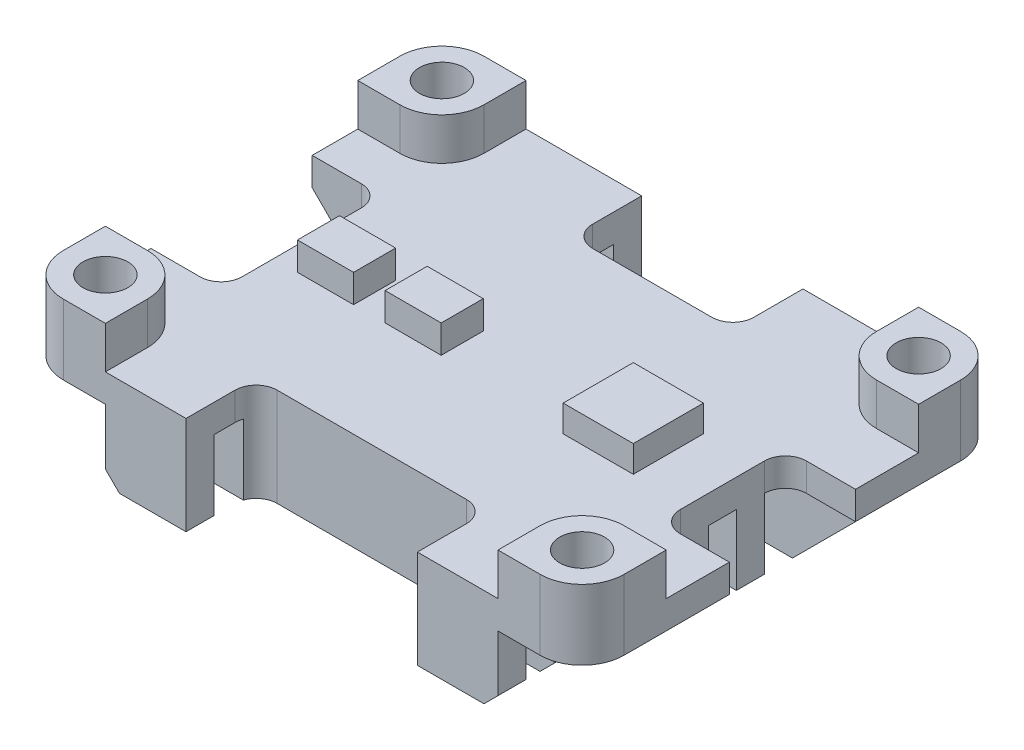
from build123d import *

# Parameters (mm, degrees)
SKETCH_1_R          = 1.6
EXTRUDE_1_DEPTH     = 7
SKETCH_2_R          = 1.6
SKETCH_2_W          = 5
SKETCH_2_H          = 5
SKETCH_2_W_2        = 4
SKETCH_2_H_2        = 3
EXTRUDE_2_DEPTH     = 3
CUT_EXTRUDE_1_DEPTH = 31
CUT_EXTRUDE_START   = -5
SKETCH_5_W          = 40
SKETCH_5_H          = 2
SKETCH_5_W_2        = 30
CUT_EXTRUDE_2_DEPTH = 5
CUT_EXTRUDE_START_2 = -31
SKETCH_6_R          = 1.6
CUT_EXTRUDE_3_DEPTH = 31
CHAMFER_1_SIZE      = 5
CHAMFER_2_SIZE      = 5
CHAMFER_3_SIZE      = 1
SKETCH_7_W          = 9.893762321
SKETCH_7_H          = 9.992699944
CUT_EXTRUDE_4_DEPTH = 1.1
SKETCH_8_W          = 19.688587018
SKETCH_8_H          = 7.420321741
CUT_EXTRUDE_5_DEPTH = 1


with BuildPart() as part:
    # Эскиз1 → Бобышка-Вытянуть1 (new body)
    with BuildSketch(Plane(origin=(0, 0, 0), x_dir=(1, 0, 0), z_dir=(0, 1, 0))):
        with BuildLine():
            Line((-17, 15), (17, 15))
            ThreePointArc((17, 15), (19.121320344, 14.121320344), (20, 12))
            Line((20, 12), (20, -12))
            ThreePointArc((20, -12), (19.121320344, -14.121320344), (17, -15))
            Line((17, -15), (-17, -15))
            ThreePointArc((-17, -15), (-19.121320344, -14.121320344), (-20, -12))
            Line((-20, -12), (-20, 12))
            ThreePointArc((-20, 12), (-19.121320344, 14.121320344), (-17, 15))
        make_face()
        with Locations(Location((-17, 12, 0), (0, 0, 270))):
            Circle(SKETCH_1_R, mode=Mode.SUBTRACT)
        with Locations(Location((17, 12, 0), (0, 0, 270))):
            Circle(SKETCH_1_R, mode=Mode.SUBTRACT)
        with Locations(Location((17, -12, 0), (0, 0, 270))):
            Circle(SKETCH_1_R, mode=Mode.SUBTRACT)
        with Locations(Location((-17, -12, 0), (0, 0, 270))):
            Circle(SKETCH_1_R, mode=Mode.SUBTRACT)
    extrude(amount=EXTRUDE_1_DEPTH)

    # Эскиз2 → Бобышка-Вытянуть2 (add)
    # profile 1 of 7: a face of its own
    with BuildSketch(Plane(origin=(0, 7, 0), x_dir=(1, 0, 0), z_dir=(0, 1, 0))):
        with BuildLine():
            Line((-17, 9), (-20, 9))
            Line((-20, 9), (-20, 12))
            ThreePointArc((-20, 12), (-19.121320344, 14.121320344), (-17, 15))
            Line((-17, 15), (-14, 15))
            Line((-14, 15), (-14, 12))
            ThreePointArc((-14, 12), (-14.878679656, 9.878679656), (-17, 9))
        make_face()
        with Locations(Location((-17, 12, 0), (0, 0, 270))):
            Circle(SKETCH_2_R, mode=Mode.SUBTRACT)
    # profile 2 of 7: a face of its own
    with BuildSketch(Plane(origin=(0, 7, 0), x_dir=(1, 0, 0), z_dir=(0, 1, 0))):
        with BuildLine():
            Line((14, 12), (14, 15))
            Line((14, 15), (17, 15))
            ThreePointArc((17, 15), (19.121320344, 14.121320344), (20, 12))
            Line((20, 12), (20, 9))
            Line((20, 9), (17, 9))
            ThreePointArc((17, 9), (14.878679656, 9.878679656), (14, 12))
        make_face()
        with Locations(Location((17, 12, 0), (0, 0, 270))):
            Circle(SKETCH_2_R, mode=Mode.SUBTRACT)
    # profile 3 of 7: a face of its own
    with BuildSketch(Plane(origin=(0, 7, 0), x_dir=(1, 0, 0), z_dir=(0, 1, 0))):
        with BuildLine():
            Line((17, -9), (20, -9))
            Line((20, -9), (20, -12))
            ThreePointArc((20, -12), (19.121320344, -14.121320344), (17, -15))
            Line((17, -15), (14, -15))
            Line((14, -15), (14, -12))
            ThreePointArc((14, -12), (14.878679656, -9.878679656), (17, -9))
        make_face()
        with Locations(Location((17, -12, 0), (0, 0, 270))):
            Circle(SKETCH_2_R, mode=Mode.SUBTRACT)
    # profile 4 of 7: a face of its own
    with BuildSketch(Plane(origin=(0, 7, 0), x_dir=(1, 0, 0), z_dir=(0, 1, 0))):
        with BuildLine():
            Line((-17, -9), (-20, -9))
            Line((-20, -9), (-20, -12))
            ThreePointArc((-20, -12), (-19.121320344, -14.121320344), (-17, -15))
            Line((-17, -15), (-14, -15))
            Line((-14, -15), (-14, -12))
            ThreePointArc((-14, -12), (-14.878679656, -9.878679656), (-17, -9))
        make_face()
        with Locations(Location((-17, -12, 0), (0, 0, 270))):
            Circle(SKETCH_2_R, mode=Mode.SUBTRACT)
    # profile 5 of 7: a face of its own
    with BuildSketch(Plane(origin=(0, 7, 0), x_dir=(1, 0, 0), z_dir=(0, 1, 0))):
        with Locations((8.65, 0)):
            Rectangle(SKETCH_2_W, SKETCH_2_H)
    # profile 6 of 7: a face of its own
    with BuildSketch(Plane(origin=(0, 7, 0), x_dir=(1, 0, 0), z_dir=(0, 1, 0))):
        with Locations((-5.05, -0.5)):
            Rectangle(SKETCH_2_W_2, SKETCH_2_H_2)
    # profile 7 of 7: a face of its own
    with BuildSketch(Plane(origin=(0, 7, 0), x_dir=(1, 0, 0), z_dir=(0, 1, 0))):
        with Locations((-11.3, -0.5)):
            Rectangle(SKETCH_2_W_2, SKETCH_2_H_2)
    extrude(amount=EXTRUDE_2_DEPTH)

    # Эскиз4 → Вырез-Вытянуть1 (cut)
    with BuildSketch(Plane.XZ):
        with BuildLine():
            Line((-5.75, -20), (5.75, -20))
            Line((5.75, -20), (5.75, -11.5))
            ThreePointArc((5.75, -11.5), (5.310660172, -10.439339828), (4.25, -10))
            Line((4.25, -10), (-4.25, -10))
            ThreePointArc((-4.25, -10), (-5.310660172, -10.439339828), (-5.75, -11.5))
            Line((-5.75, -11.5), (-5.75, -20))
        make_face()
        with BuildLine():
            Line((-25, 5.75), (-16.5, 5.75))
            ThreePointArc((-16.5, 5.75), (-15.439339828, 5.310660172), (-15, 4.25))
            Line((-15, 4.25), (-15, -4.25))
            ThreePointArc((-15, -4.25), (-15.439339828, -5.310660172), (-16.5, -5.75))
            Line((-16.5, -5.75), (-25, -5.75))
            Line((-25, -5.75), (-25, 5.75))
        make_face()
        with BuildLine():
            Line((-8.25, 20), (8.25, 20))
            Line((8.25, 20), (8.25, 11.5))
            ThreePointArc((8.25, 11.5), (7.810660172, 10.439339828), (6.75, 10))
            Line((6.75, 10), (-6.75, 10))
            ThreePointArc((-6.75, 10), (-7.810660172, 10.439339828), (-8.25, 11.5))
            Line((-8.25, 11.5), (-8.25, 20))
        make_face()
        with BuildLine():
            Line((25, 4.5), (16.5, 4.5))
            ThreePointArc((16.5, 4.5), (15.439339828, 4.060660172), (15, 3))
            Line((15, 3), (15, -3))
            ThreePointArc((15, -3), (15.439339828, -4.060660172), (16.5, -4.5))
            Line((16.5, -4.5), (25, -4.5))
            Line((25, -4.5), (25, 4.5))
        make_face()
    extrude(amount=-CUT_EXTRUDE_1_DEPTH, mode=Mode.SUBTRACT)

    # Эскиз5 → Вырез-Вытянуть2 (cut)
    with BuildSketch(Plane.XZ.offset(CUT_EXTRUDE_START)):
        with BuildLine():
            Line((-5.664213562, -11), (-15.7510004, -11))
            ThreePointArc((-15.7510004, -11), (-15.490298149, -11.470094046), (-15.4, -12))
            ThreePointArc((-15.4, -12), (-15.490298149, -12.529905954), (-15.7510004, -13))
            Line((-15.7510004, -13), (-5.75, -13))
            Line((-5.75, -13), (-5.75, -11.5))
            ThreePointArc((-5.75, -11.5), (-5.728397839, -11.246347032), (-5.664213562, -11))
        make_face()
        with BuildLine():
            ThreePointArc((15.7510004, -13), (15.4, -12), (15.7510004, -11))
            Line((15.7510004, -11), (5.664213562, -11))
            ThreePointArc((5.664213562, -11), (5.728397839, -11.246347032), (5.75, -11.5))
            Line((5.75, -11.5), (5.75, -13))
            Line((5.75, -13), (15.7510004, -13))
        make_face()
        with BuildLine():
            Line((20, -12), (20, -11))
            Line((20, -11), (18.2489996, -11))
            ThreePointArc((18.2489996, -11), (18.509701851, -11.470094046), (18.6, -12))
            ThreePointArc((18.6, -12), (18.509701851, -12.529905954), (18.2489996, -13))
            Line((18.2489996, -13), (19.828427125, -13))
            ThreePointArc((19.828427125, -13), (19.956795679, -12.507305936), (20, -12))
        make_face()
        with BuildLine():
            Line((-18.2489996, -11), (-20, -11))
            Line((-20, -11), (-20, -12))
            ThreePointArc((-20, -12), (-19.956795679, -12.507305936), (-19.828427125, -13))
            Line((-19.828427125, -13), (-18.2489996, -13))
            ThreePointArc((-18.2489996, -13), (-18.6, -12), (-18.2489996, -11))
        make_face()
        with Locations((0, -8)):
            Rectangle(SKETCH_5_W, SKETCH_5_H)
        with BuildLine():
            Line((15, -3), (-15, -3))
            Line((-15, -3), (-15, -4.25))
            ThreePointArc((-15, -4.25), (-15.051111261, -4.638228568), (-15.200961894, -5))
            Line((-15.200961894, -5), (20, -5))
            Line((20, -5), (20, -4.5))
            Line((20, -4.5), (16.5, -4.5))
            ThreePointArc((16.5, -4.5), (15.439339828, -4.060660172), (15, -3))
        make_face()
        Rectangle(SKETCH_5_W_2, SKETCH_5_H)
        with BuildLine():
            Line((20, 5), (-15.200961894, 5))
            ThreePointArc((-15.200961894, 5), (-15.051111261, 4.638228568), (-15, 4.25))
            Line((-15, 4.25), (-15, 3))
            Line((-15, 3), (15, 3))
            ThreePointArc((15, 3), (15.439339828, 4.060660172), (16.5, 4.5))
            Line((16.5, 4.5), (20, 4.5))
            Line((20, 4.5), (20, 5))
        make_face()
        with Locations((0, 8)):
            Rectangle(SKETCH_5_W, SKETCH_5_H)
        with BuildLine():
            ThreePointArc((-15.4, 12), (-15.490298149, 11.470094046), (-15.7510004, 11))
            Line((-15.7510004, 11), (-8.164213562, 11))
            ThreePointArc((-8.164213562, 11), (-8.228397839, 11.246347032), (-8.25, 11.5))
            Line((-8.25, 11.5), (-8.25, 13))
            Line((-8.25, 13), (-15.7510004, 13))
            ThreePointArc((-15.7510004, 13), (-15.490298149, 12.529905954), (-15.4, 12))
        make_face()
        with BuildLine():
            Line((-20, 12), (-20, 11))
            Line((-20, 11), (-18.2489996, 11))
            ThreePointArc((-18.2489996, 11), (-18.6, 12), (-18.2489996, 13))
            Line((-18.2489996, 13), (-19.828427125, 13))
            ThreePointArc((-19.828427125, 13), (-19.956795679, 12.507305936), (-20, 12))
        make_face()
        with BuildLine():
            Line((8.164213562, 11), (15.7510004, 11))
            ThreePointArc((15.7510004, 11), (15.4, 12), (15.7510004, 13))
            Line((15.7510004, 13), (8.25, 13))
            Line((8.25, 13), (8.25, 11.5))
            ThreePointArc((8.25, 11.5), (8.228397839, 11.246347032), (8.164213562, 11))
        make_face()
        with BuildLine():
            Line((18.2489996, 11), (20, 11))
            Line((20, 11), (20, 12))
            ThreePointArc((20, 12), (19.956795679, 12.507305936), (19.828427125, 13))
            Line((19.828427125, 13), (18.2489996, 13))
            ThreePointArc((18.2489996, 13), (18.509701851, 12.529905954), (18.6, 12))
            ThreePointArc((18.6, 12), (18.509701851, 11.470094046), (18.2489996, 11))
        make_face()
    extrude(amount=CUT_EXTRUDE_2_DEPTH, mode=Mode.SUBTRACT)

    # Эскиз6 → Вырез-Вытянуть3 (cut)
    # profile 1 of 4: a face of its own
    with BuildSketch(Plane(origin=(0, 5, 0), x_dir=(1, 0, 0), z_dir=(0, 1, 0)).offset(CUT_EXTRUDE_START_2)):
        with BuildLine():
            Line((14, 12), (14, 9))
            Line((14, 9), (17, 9))
            Line((17, 9), (20, 9))
            Line((20, 9), (20, 12))
            ThreePointArc((20, 12), (19.121320344, 14.121320344), (17, 15))
            Line((17, 15), (14, 15))
            Line((14, 15), (14, 12))
        make_face()
        with Locations(Location((17, 12, 0), (0, 0, 270))):
            Circle(SKETCH_6_R, mode=Mode.SUBTRACT)
    # profile 2 of 4: a face of its own
    with BuildSketch(Plane(origin=(0, 5, 0), x_dir=(1, 0, 0), z_dir=(0, 1, 0)).offset(CUT_EXTRUDE_START_2)):
        with BuildLine():
            Line((14, -12), (14, -9))
            Line((14, -9), (17, -9))
            Line((17, -9), (20, -9))
            Line((20, -9), (20, -12))
            ThreePointArc((20, -12), (19.121320344, -14.121320344), (17, -15))
            Line((17, -15), (14, -15))
            Line((14, -15), (14, -12))
        make_face()
        with Locations(Location((17, -12, 0), (0, 0, 270))):
            Circle(SKETCH_6_R, mode=Mode.SUBTRACT)
    # profile 3 of 4: a face of its own
    with BuildSketch(Plane(origin=(0, 5, 0), x_dir=(1, 0, 0), z_dir=(0, 1, 0)).offset(CUT_EXTRUDE_START_2)):
        with BuildLine():
            Line((-20, 9), (-17, 9))
            Line((-17, 9), (-14, 9))
            Line((-14, 9), (-14, 12))
            Line((-14, 12), (-14, 15))
            Line((-14, 15), (-17, 15))
            ThreePointArc((-17, 15), (-19.121320344, 14.121320344), (-20, 12))
            Line((-20, 12), (-20, 9))
        make_face()
        with Locations(Location((-17, 12, 0), (0, 0, 270))):
            Circle(SKETCH_6_R, mode=Mode.SUBTRACT)
    # profile 4 of 4: a face of its own
    with BuildSketch(Plane(origin=(0, 5, 0), x_dir=(1, 0, 0), z_dir=(0, 1, 0)).offset(CUT_EXTRUDE_START_2)):
        with BuildLine():
            Line((-14, -15), (-14, -12))
            Line((-14, -12), (-14, -9))
            Line((-14, -9), (-17, -9))
            Line((-17, -9), (-20, -9))
            Line((-20, -9), (-20, -12))
            ThreePointArc((-20, -12), (-19.121320344, -14.121320344), (-17, -15))
            Line((-17, -15), (-14, -15))
        make_face()
        with Locations(Location((-17, -12, 0), (0, 0, 270))):
            Circle(SKETCH_6_R, mode=Mode.SUBTRACT)
    extrude(amount=CUT_EXTRUDE_3_DEPTH, mode=Mode.SUBTRACT)

    # Фаска1
    chamfer_1_edges = [part.edges().sort_by_distance(p)[0] for p in [
        (20, 0, 6),
        (20, 0, -6),
    ]]
    chamfer(chamfer_1_edges, length=CHAMFER_1_SIZE)

    # Фаска2
    chamfer_2_edges = [part.edges().sort_by_distance(p)[0] for p in [
        (-20, 0, 6.375),
        (-20, 0, -6.375),
    ]]
    chamfer(chamfer_2_edges, length=CHAMFER_2_SIZE)

    # Фаска3
    chamfer_3_edges = [part.edges().sort_by_distance(p)[0] for p in [
        (-14, 0, 10),
        (-14, 0, 14),
        (14, 0, -14),
        (14, 0, -10),
        (14, 0, 10),
        (14, 0, 14),
        (-14, 0, -14),
        (-14, 0, -10),
    ]]
    chamfer(chamfer_3_edges, length=CHAMFER_3_SIZE)

    # Эскиз7 → Вырез-Вытянуть4 (cut)
    with BuildSketch(Plane(origin=(0, 10, 0), x_dir=(1, 0, 0), z_dir=(0, 1, 0))):
        with Locations((8.731245249, 0)):
            Rectangle(SKETCH_7_W, SKETCH_7_H)
    extrude(amount=-CUT_EXTRUDE_4_DEPTH, mode=Mode.SUBTRACT)

    # Эскиз8 → Вырез-Вытянуть5 (cut)
    with BuildSketch(Plane(origin=(0, 10, 0), x_dir=(1, 0, 0), z_dir=(0, 1, 0))):
        with Locations((-7.741869016, -0.59362574)):
            Rectangle(SKETCH_8_W, SKETCH_8_H)
    extrude(amount=-CUT_EXTRUDE_5_DEPTH, mode=Mode.SUBTRACT)


solid = part.part
